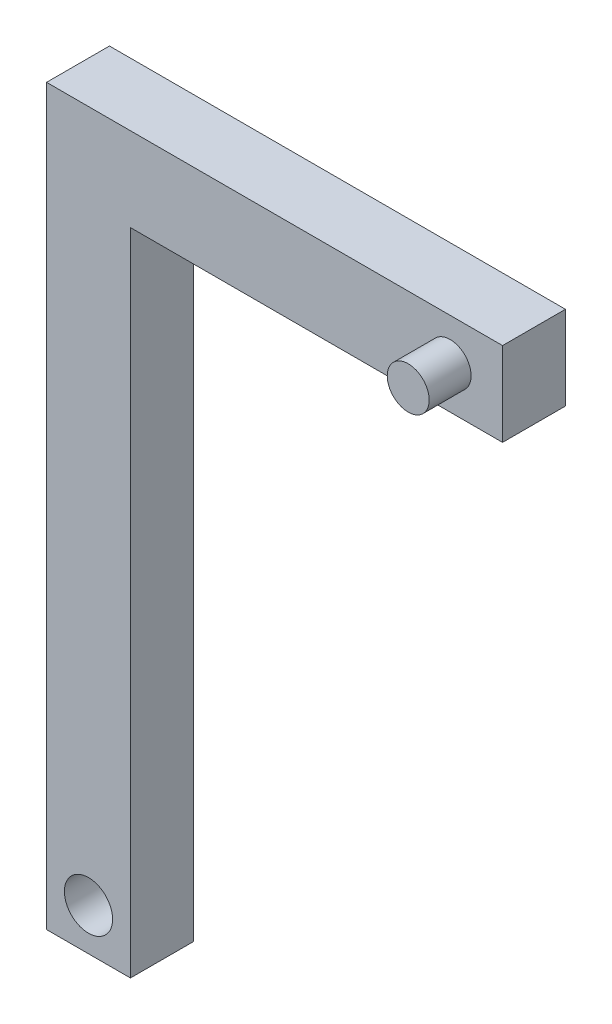
from build123d import *

# Parameters (mm, degrees)
CROQUIS1_W              = 22.5
CROQUIS1_H              = 4
SALIENTE_EXTRUIR1_DEPTH = 3
CROQUIS5_W              = 4
CROQUIS5_H              = 31
CROQUIS5_R              = 1.05
SALIENTE_EXTRUIR3_DEPTH = 3
CROQUIS10_W             = 1.164205216
CROQUIS10_H             = 4.577506348
CORTAR_EXTRUIR4_DEPTH   = 42.716303767
CROQUIS3_R              = 1
SALIENTE_EXTRUIR4_DEPTH = 5
CROQUIS11_R             = 1.15
CORTAR_EXTRUIR5_DEPTH   = 42.907636536


with BuildPart() as part:
    # Croquis1 → Saliente-Extruir1 (new body)
    with BuildSketch(Plane.XY):
        with Locations((11.25, -2)):
            Rectangle(CROQUIS1_W, CROQUIS1_H)
    extrude(amount=SALIENTE_EXTRUIR1_DEPTH)

    # Croquis5 → Saliente-Extruir3 (add)
    with BuildSketch(Plane(origin=(0, 0, 0), x_dir=(-1, 0, 0), z_dir=(0, 0, -1))):
        with Locations((-2.75, -19.5)):
            Rectangle(CROQUIS5_W, CROQUIS5_H)
        with Locations((-2.75, -33)):
            Circle(CROQUIS5_R, mode=Mode.SUBTRACT)
    extrude(amount=-SALIENTE_EXTRUIR3_DEPTH)

    # Croquis10 → Cortar-Extruir4 (cut, through all)
    with BuildSketch(Plane.XY.offset(3)):
        with Locations((0.167897392, -1.711246826)):
            Rectangle(CROQUIS10_W, CROQUIS10_H)
    extrude(amount=-CORTAR_EXTRUIR4_DEPTH, mode=Mode.SUBTRACT)

    # Croquis3 → Saliente-Extruir4 (add)
    with BuildSketch(Plane(origin=(0, 0, 0), x_dir=(-1, 0, 0), z_dir=(0, 0, -1))):
        with Locations((-20, -2)):
            Circle(CROQUIS3_R)
    extrude(amount=-SALIENTE_EXTRUIR4_DEPTH)

    # Croquis11 → Cortar-Extruir5 (cut, through all)
    with BuildSketch(Plane(origin=(0, 0, 0), x_dir=(-1, 0, 0), z_dir=(0, 0, -1))):
        with Locations((-2.75, -33)):
            Circle(CROQUIS11_R)
    extrude(amount=-CORTAR_EXTRUIR5_DEPTH, mode=Mode.SUBTRACT)


solid = part.part
